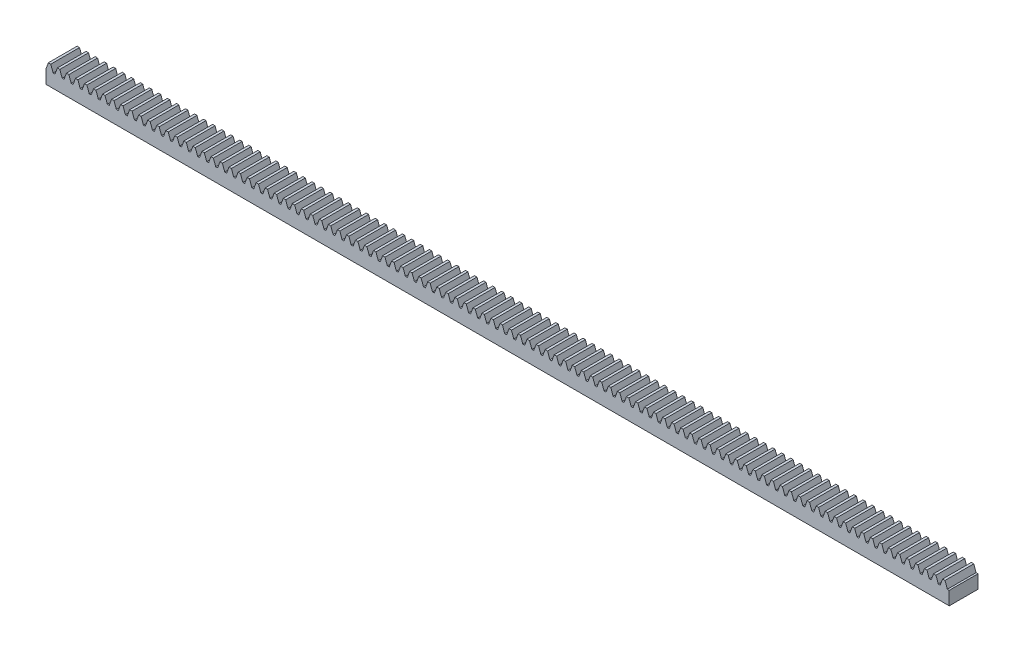
from build123d import *

# Parameters (mm, degrees)
SKETCH_1_W             = 628.318530718
SKETCH_1_H             = 9.35
EXTRUDE_1_DEPTH        = 20
EXTRUDE_2_DEPTH        = 20
PATTERN_LINEAR_1_COUNT = 100
PATTERN_LINEAR_1_PITCH = 6.283185307


with BuildPart() as part:
    # 草图1 → 拉伸1 (new body)
    with BuildSketch(Plane.XY):
        with Locations((314.159265359, -4.675)):
            Rectangle(SKETCH_1_W, SKETCH_1_H)
    extrude(amount=EXTRUDE_1_DEPTH)

    # 草图2 → 拉伸2 (add)
    with BuildSketch(Plane.XY.offset(20)):
        Polygon((0, 0), (1.637866054, 4.5), (3.323577771, 4.5), (4.961443825, 0), align=None)
    extrude_2 = extrude(amount=-EXTRUDE_2_DEPTH)

    # 阵列(线性)1: 拉伸2 ×100
    with Locations(*[(i * PATTERN_LINEAR_1_PITCH, 0, 0) for i in range(1, PATTERN_LINEAR_1_COUNT)]):
        add(extrude_2)


solid = part.part
